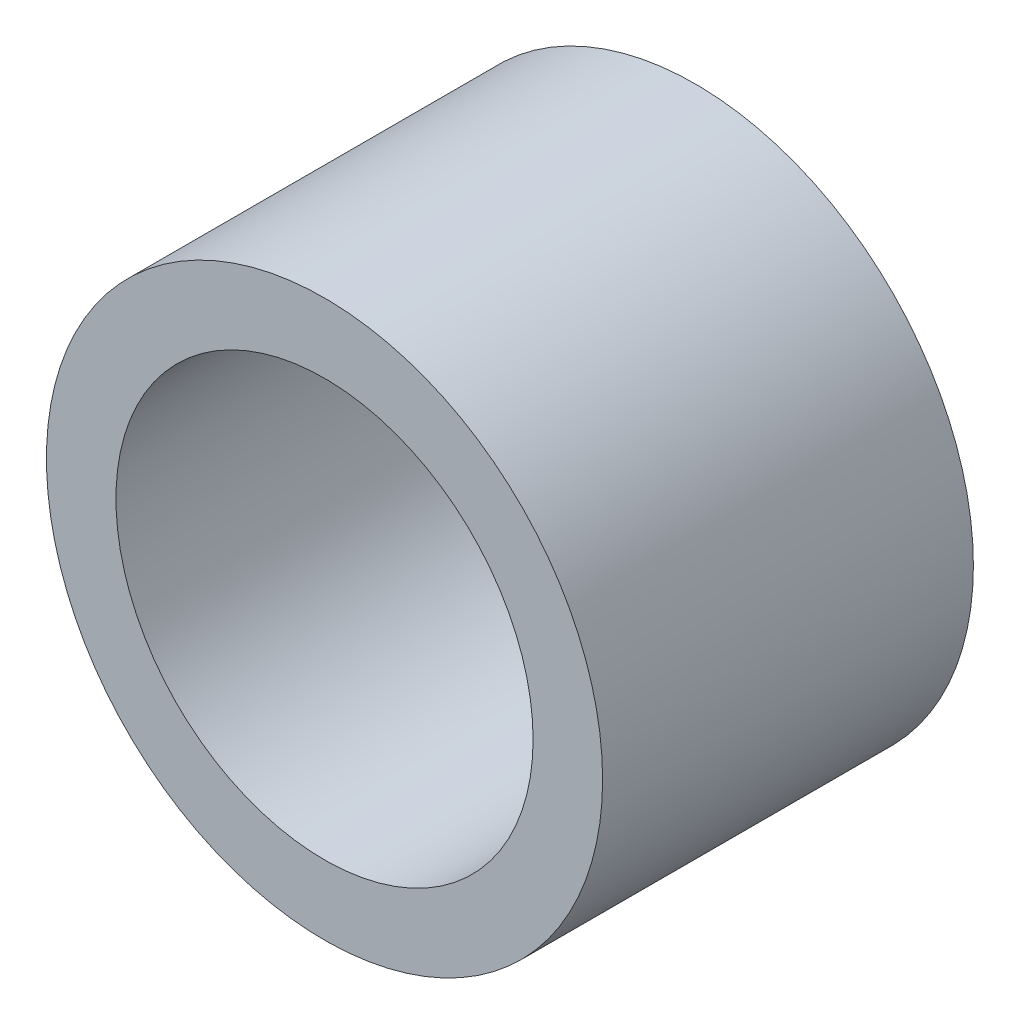
from build123d import *

# Parameters (mm, degrees)
ESQUISSE1_R        = 60
ESQUISSE1_R_2      = 45
BOSS_EXTRU_1_DEPTH = 80


with BuildPart() as part:
    # Esquisse1 → Boss.-Extru.1 (new body)
    with BuildSketch(Plane.XY):
        Circle(ESQUISSE1_R)
        Circle(ESQUISSE1_R_2, mode=Mode.SUBTRACT)
    extrude(amount=BOSS_EXTRU_1_DEPTH)


solid = part.part
